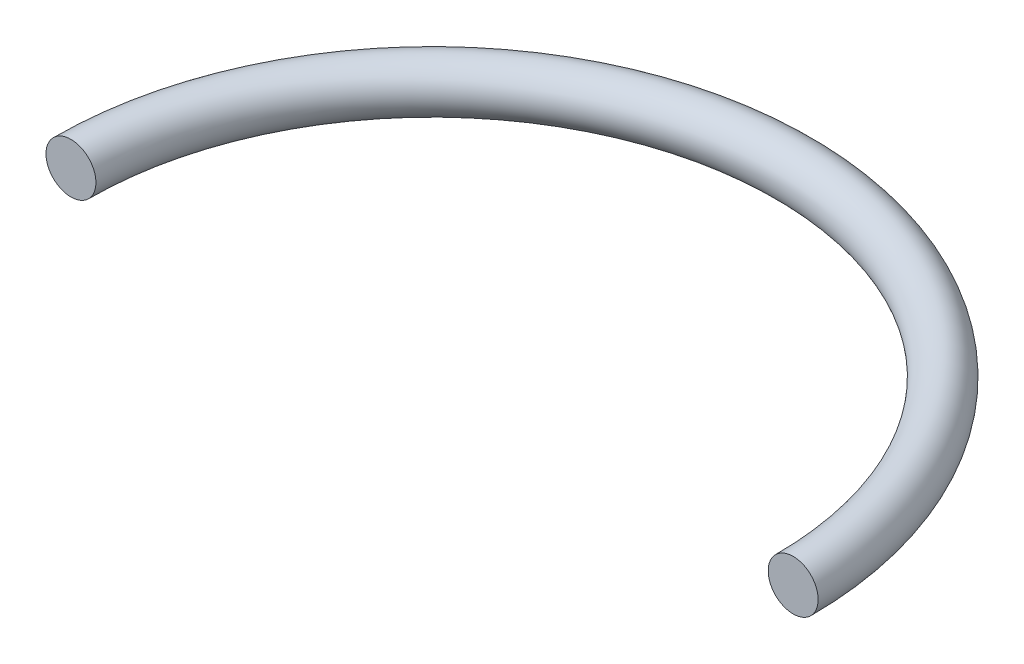
from build123d import *

# Parameters (mm, degrees)
SKETCH1_R      = 0.65
REVOLVE1_ANGLE = 180


with BuildPart() as part:
    # Sketch1 → Revolve1 (revolve)
    with BuildSketch(Plane.XY):
        with Locations((-9.4, 0)):
            Circle(SKETCH1_R)
    revolve(axis=Axis((0, 7.412747286, 0), (0, -1, 0)), revolution_arc=REVOLVE1_ANGLE)


solid = part.part
